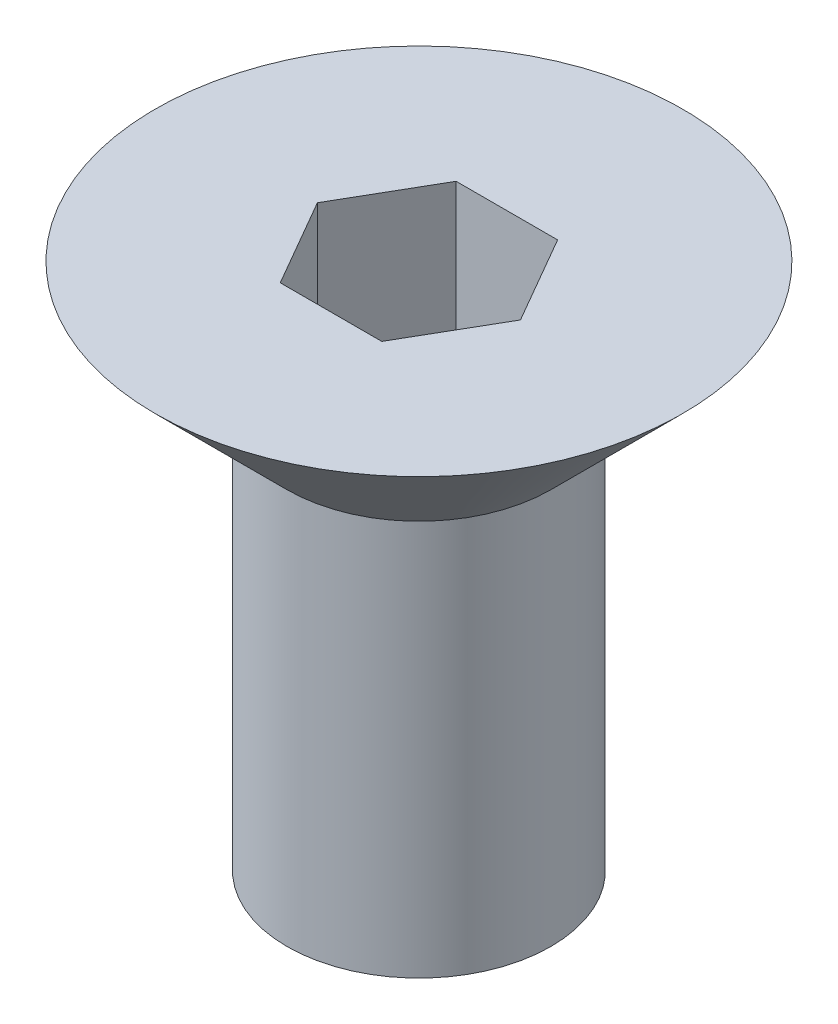
from build123d import *

# Parameters (mm, degrees)
CUT_EXTRUDE1_DEPTH = 3


with BuildPart() as part:
    # Sketch1 → Revolve1 (revolve)
    with BuildSketch(Plane.XY, mode=Mode.PRIVATE) as revolve1_sk:
        Polygon((0, -12), (3, -12), (3, -3), (6, 0), (0, 0), align=None)
    revolve(revolve1_sk.sketch.rotate(Axis((0, 61.691642626, 0), (0, -1, 0)), 90), axis=Axis((0, 61.691642626, 0), (0, -1, 0)))

    # Sketch2 → Cut-Extrude1 (cut)
    with BuildSketch(Plane(origin=(0, 0, 0), x_dir=(-1, 0, 0), z_dir=(0, 1, 0))):
        Polygon((-1.154700538, -2), (1.154700538, -2), (2.309401077, 0), (1.154700538, 2), (-1.154700538, 2), (-2.309401077, 0), align=None)
    extrude(amount=-CUT_EXTRUDE1_DEPTH, mode=Mode.SUBTRACT)


solid = part.part
